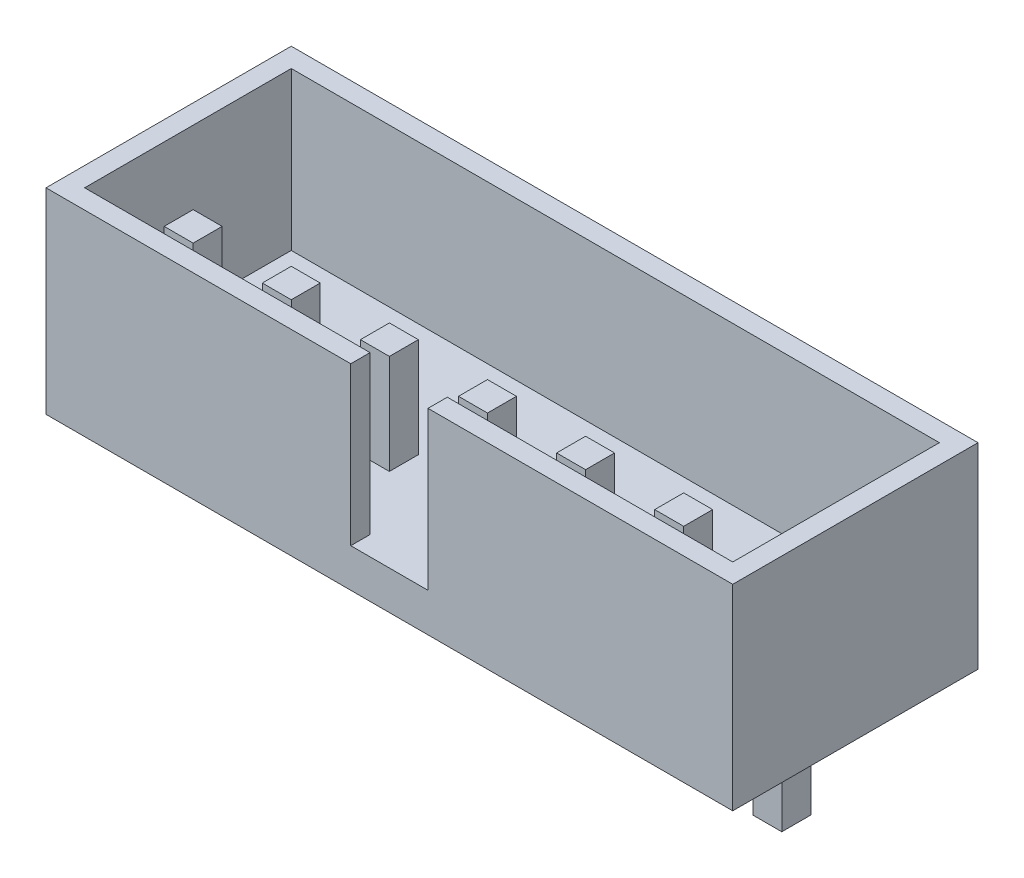
from build123d import *

# Parameters (mm, degrees)
SKETCH_1_W           = 17.78
SKETCH_1_H           = 6.35
EXTRUDE_1_DEPTH      = 5.08
SKETCH_2_W           = 16.78
SKETCH_2_H           = 5.35
CUT_EXTRUDE_1_DEPTH  = 4.08
SKETCH_3_W           = 2
SKETCH_3_H           = 4.08
CUT_EXTRUDE_2_DEPTH  = 1
EXTRUDE_2_DEPTH      = 2
EXTRUDE_2_DEPTH_BACK = 3.58
SKETCH_4_W           = 0.75
SKETCH_4_H           = 0.75


with BuildPart() as part:
    # 草图1 → 拉伸1 (new body)
    with BuildSketch(Plane(origin=(0, 0, 0), x_dir=(1, 0, 0), z_dir=(0, 1, 0))):
        Rectangle(SKETCH_1_W, SKETCH_1_H)
    extrude(amount=EXTRUDE_1_DEPTH)

    # 草图2 → 切除-拉伸1 (cut)
    with BuildSketch(Plane(origin=(0, 5.08, 0), x_dir=(-1, 0, 0), z_dir=(0, 1, 0))):
        Rectangle(SKETCH_2_W, SKETCH_2_H)
    extrude(amount=-CUT_EXTRUDE_1_DEPTH, mode=Mode.SUBTRACT)

    # 草图3 → 切除-拉伸2 (cut)
    with BuildSketch(Plane.XY.offset(3.175)):
        with Locations((0, 3.04)):
            Rectangle(SKETCH_3_W, SKETCH_3_H)
    extrude(amount=-CUT_EXTRUDE_2_DEPTH, mode=Mode.SUBTRACT)

    # 草图4 → 拉伸2 (add, two sides: drawn at the far end of the back side and taken through both)
    with BuildSketch(Plane.XZ.offset(-EXTRUDE_2_DEPTH_BACK)):
        with Locations((5.08, 0.635)):
            Rectangle(SKETCH_4_W, SKETCH_4_H)
        with Locations((0, 0.635)):
            Rectangle(SKETCH_4_W, SKETCH_4_H)
        with Locations((2.54, 0.635)):
            Rectangle(SKETCH_4_W, SKETCH_4_H)
        with Locations((7.62, 0.635)):
            Rectangle(SKETCH_4_W, SKETCH_4_H)
        with Locations((-2.54, 0.635)):
            Rectangle(SKETCH_4_W, SKETCH_4_H)
        with Locations((-7.62, 0.635)):
            Rectangle(SKETCH_4_W, SKETCH_4_H)
        with Locations((-5.08, 0.635)):
            Rectangle(SKETCH_4_W, SKETCH_4_H)
    extrude(amount=EXTRUDE_2_DEPTH + EXTRUDE_2_DEPTH_BACK)


solid = part.part
